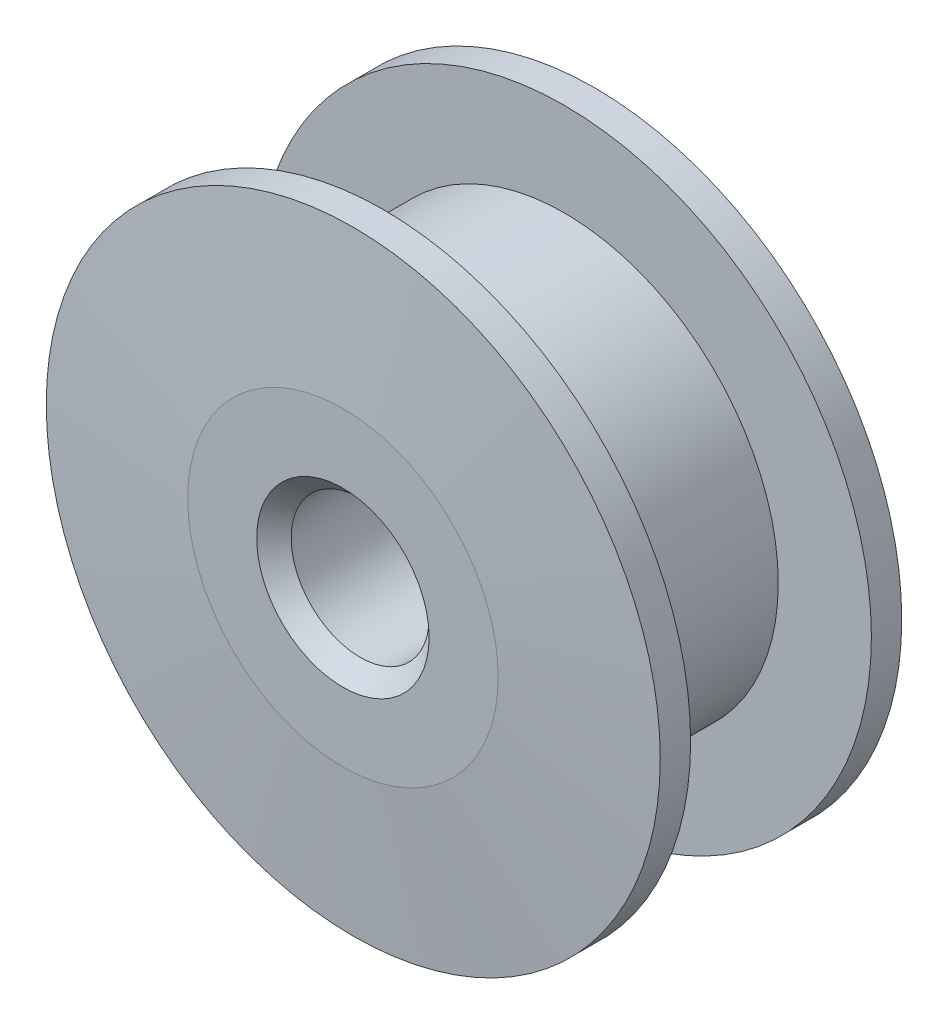
from build123d import *

# Parameters (mm, degrees)
SKETCH_1_R          = 4.45
EXTRUDE_1_DEPTH     = 1.9
SKETCH_2_R          = 4.45
SKETCH_2_R_2        = 3.1
CUT_EXTRUDE_2_DEPTH = 1.31
SKETCH_3_R          = 1
CUT_EXTRUDE_3_DEPTH = 3.8
CHAMFER_1_SIZE      = 0.25
CHAMFER_2_SIZE      = 2
CHAMFER_2_SIZE2     = 0.15
CHAMFER_3_SIZE      = 0.15
CHAMFER_3_SIZE2     = 2.2


with BuildPart() as part:
    # 草图1 → 拉伸1 (new, symmetric)
    with BuildSketch(Plane.XY):
        with Locations(Location((0, 0, 0), (0, 0, 180))):
            Circle(SKETCH_1_R)
    extrude(amount=EXTRUDE_1_DEPTH, both=True)

    # 草图2 → 拉伸2 (cut, symmetric)
    with BuildSketch(Plane.XY):
        with Locations(Location((0, 0, 0), (0, 0, 180))):
            Circle(SKETCH_2_R)
        Circle(SKETCH_2_R_2, mode=Mode.SUBTRACT)
    extrude(amount=CUT_EXTRUDE_2_DEPTH, both=True, mode=Mode.SUBTRACT)

    # 草图3 → 拉伸3 (cut)
    with BuildSketch(Plane.XY.offset(1.9)):
        Circle(SKETCH_3_R)
    extrude(amount=-CUT_EXTRUDE_3_DEPTH, mode=Mode.SUBTRACT)

    # 倒角1
    chamfer_1_edges = [part.edges().sort_by_distance(p)[0] for p in [
        (-1, 0, 1.9),
        (-1, 0, -1.9),
    ]]
    chamfer(chamfer_1_edges, length=CHAMFER_1_SIZE)

    # 倒角2
    chamfer_2_edges = [part.edges().sort_by_distance(p)[0] for p in [
        (4.45, 0, -1.9),
    ]]
    chamfer_2_side = [part.faces().sort_by_distance(p)[0] for p in [
        (-1.375865007, 0, -1.9),
    ]]
    chamfer(chamfer_2_edges, length=CHAMFER_2_SIZE, length2=CHAMFER_2_SIZE2, reference=chamfer_2_side[0])

    # 倒角3
    chamfer_3_edges = [part.edges().sort_by_distance(p)[0] for p in [
        (4.45, 0, 1.9),
    ]]
    chamfer_3_side = [part.faces().sort_by_distance(p)[0] for p in [
        (4.45, 0, 1.605),
    ]]
    chamfer(chamfer_3_edges, length=CHAMFER_3_SIZE, length2=CHAMFER_3_SIZE2, reference=chamfer_3_side[0])


solid = part.part
